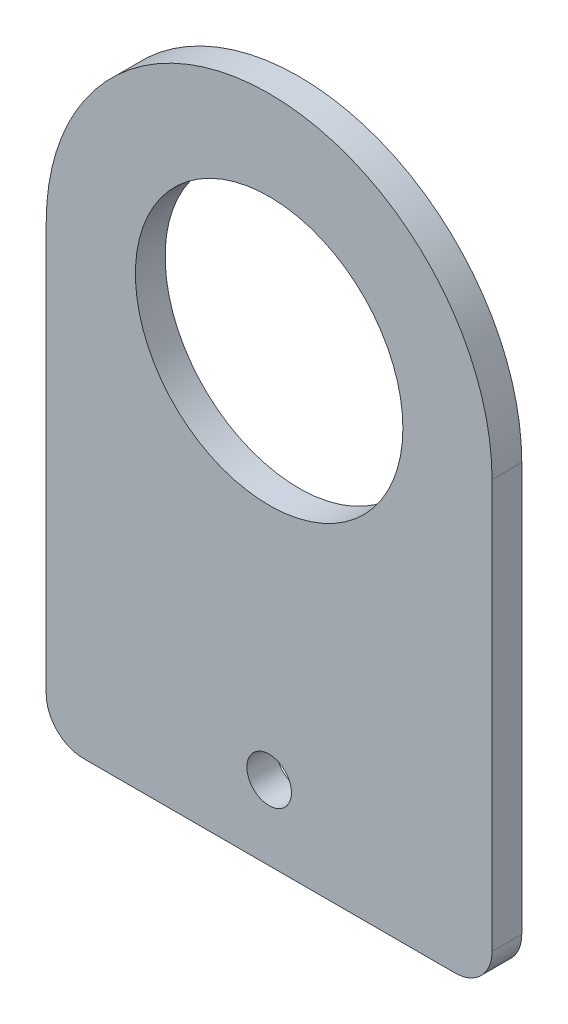
from build123d import *

# Parameters (mm, degrees)
SKETCH3_R           = 8.99999978
SKETCH3_R_2         = 1.49999954
BOSS_EXTRUDE1_DEPTH = 2


with BuildPart() as part:
    # Sketch3 → Boss-Extrude1 (new body)
    with BuildSketch(Plane.XY):
        with BuildLine():
            Line((75.5000014, 79.49999848), (75.5000014, 94.49999896))
            ThreePointArc((75.5000014, 94.49999896), (90.50000188, 109.49999944), (105.50000236, 94.49999896))
            Line((105.50000236, 94.49999896), (105.50000236, 66.99999808))
            ThreePointArc((105.50000236, 66.99999808), (104.76776929, 65.23223107), (103.00000228, 64.499998))
            Line((103.00000228, 64.499998), (78.00000148, 64.499998))
            ThreePointArc((78.00000148, 64.499998), (76.23223447, 65.23223107), (75.5000014, 66.99999808))
            Line((75.5000014, 66.99999808), (75.5000014, 79.49999848))
        make_face()
        with Locations((90.50000188, 94.49999896)):
            Circle(SKETCH3_R, mode=Mode.SUBTRACT)
        with Locations((90.50000188, 69.49999816)):
            Circle(SKETCH3_R_2, mode=Mode.SUBTRACT)
    extrude(amount=BOSS_EXTRUDE1_DEPTH)


solid = part.part
